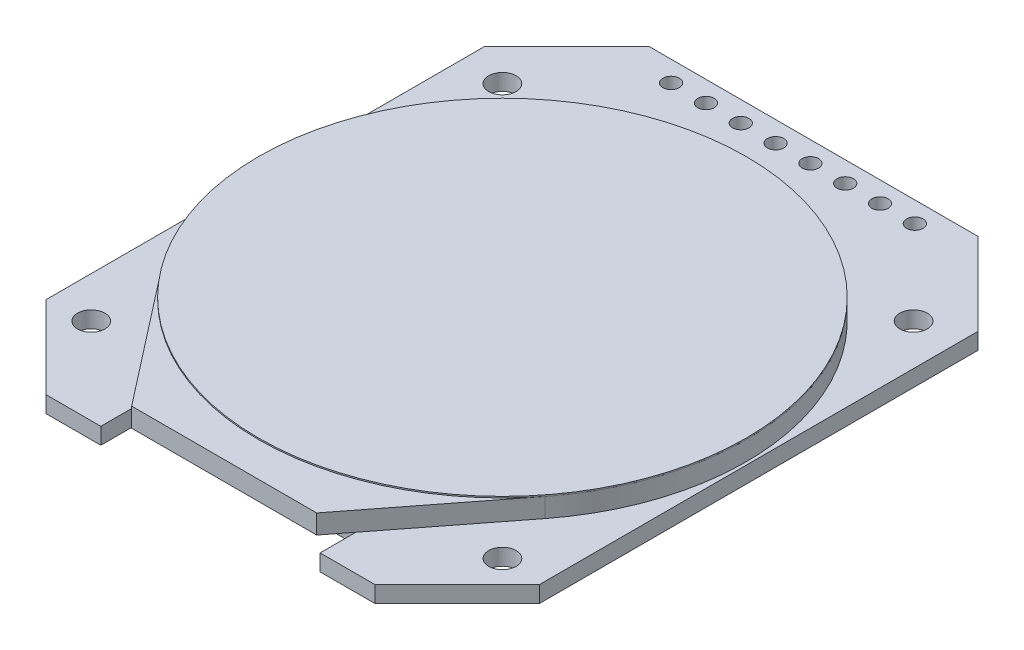
from build123d import *

# Parameters (mm, degrees)
SKETCH2_R           = 1
SKETCH2_R_2         = 0.6
SKETCH2_R_3         = 17.79
SKETCH2_R_4         = 16.2
BOSS_EXTRUDE1_DEPTH = 1.2
SKETCH2_3_R         = 17.79
SKETCH2_3_R_2       = 16.2
BOSS_EXTRUDE2_DEPTH = 1.4
BOSS_EXTRUDE3_START = 1.4
SKETCH2_4_R         = 17.79
SKETCH2_4_R_2       = 16.2
BOSS_EXTRUDE3_DEPTH = 0.1


with BuildPart() as part:
    # Sketch2 → Boss-Extrude1 (new body)
    # profile 1 of 4: a face of its own
    with BuildSketch(Plane(origin=(0, 0, 0), x_dir=(1, 0, 0), z_dir=(0, 1, 0))):
        with BuildLine():
            Line((-18, 16), (-18, -16))
            Line((-18, -16), (-12, -22))
            Line((-12, -22), (-8, -22))
            Line((-8, -22), (-8, -19.392543934))
            Line((-8, -19.392543934), (-14.043607284, -11.620677381))
            ThreePointArc((-14.043607284, -11.620677381), (-5.772708481, 16.127356797), (17.79, -0.7))
            ThreePointArc((17.79, -0.7), (16.827356797, -6.472708481), (14.043607284, -11.620677381))
            Line((14.043607284, -11.620677381), (8, -19.392543934))
            Line((8, -19.392543934), (8, -22))
            Line((8, -22), (12, -22))
            Line((12, -22), (18, -16))
            Line((18, -16), (18, 16))
            Line((18, 16), (12, 22))
            Line((12, 22), (-12, 22))
            Line((-12, 22), (-18, 16))
        make_face()
        with Locations(Location((-15, -15.7, 0), (0, 0, 270))):
            Circle(SKETCH2_R, mode=Mode.SUBTRACT)
        with Locations(Location((15, -15.7, 0), (0, 0, 270))):
            Circle(SKETCH2_R, mode=Mode.SUBTRACT)
        with Locations(Location((-15, 14.3, 0), (0, 0, 270))):
            Circle(SKETCH2_R, mode=Mode.SUBTRACT)
        with Locations(Location((-8.89, 20.5, 0), (0, 0, 270))):
            Circle(SKETCH2_R_2, mode=Mode.SUBTRACT)
        with Locations(Location((-6.35, 20.5, 0), (0, 0, 270))):
            Circle(SKETCH2_R_2, mode=Mode.SUBTRACT)
        with Locations(Location((-3.81, 20.5, 0), (0, 0, 270))):
            Circle(SKETCH2_R_2, mode=Mode.SUBTRACT)
        with Locations(Location((-1.27, 20.5, 0), (0, 0, 270))):
            Circle(SKETCH2_R_2, mode=Mode.SUBTRACT)
        with Locations(Location((1.27, 20.5, 0), (0, 0, 270))):
            Circle(SKETCH2_R_2, mode=Mode.SUBTRACT)
        with Locations(Location((3.81, 20.5, 0), (0, 0, 270))):
            Circle(SKETCH2_R_2, mode=Mode.SUBTRACT)
        with Locations(Location((6.35, 20.5, 0), (0, 0, 270))):
            Circle(SKETCH2_R_2, mode=Mode.SUBTRACT)
        with Locations(Location((8.89, 20.5, 0), (0, 0, 270))):
            Circle(SKETCH2_R_2, mode=Mode.SUBTRACT)
        with Locations(Location((15, 14.3, 0), (0, 0, 270))):
            Circle(SKETCH2_R, mode=Mode.SUBTRACT)
    # profile 2 of 4: a face of its own
    with BuildSketch(Plane(origin=(0, 0, 0), x_dir=(1, 0, 0), z_dir=(0, 1, 0))):
        with Locations((0, -0.7)):
            Circle(SKETCH2_R_3)
        with Locations((0, -0.7)):
            Circle(SKETCH2_R_4, mode=Mode.SUBTRACT)
    # profile 3 of 4: a face of its own
    with BuildSketch(Plane(origin=(0, 0, 0), x_dir=(1, 0, 0), z_dir=(0, 1, 0))):
        with Locations((0, -0.7)):
            Circle(SKETCH2_R_4)
    # profile 4 of 4: a face of its own
    with BuildSketch(Plane(origin=(0, 0, 0), x_dir=(1, 0, 0), z_dir=(0, 1, 0))):
        with BuildLine():
            Line((-14.043607284, -11.620677381), (-8, -19.392543934))
            Line((-8, -19.392543934), (-8, -19))
            Line((-8, -19), (8, -19))
            Line((8, -19), (8, -19.392543934))
            Line((8, -19.392543934), (14.043607284, -11.620677381))
            ThreePointArc((14.043607284, -11.620677381), (0, -18.49), (-14.043607284, -11.620677381))
        make_face()
    extrude(amount=-BOSS_EXTRUDE1_DEPTH)


with BuildPart() as body_2:
    # Sketch2<3> → Boss-Extrude2 (new body)
    # profile 1 of 4: a face of its own
    with BuildSketch(Plane(origin=(0, 0, 0), x_dir=(1, 0, 0), z_dir=(0, 1, 0))):
        with BuildLine():
            Line((-14.043607284, -11.620677381), (-8, -19.392543934))
            Line((-8, -19.392543934), (-8, -19))
            Line((-8, -19), (8, -19))
            Line((8, -19), (8, -19.392543934))
            Line((8, -19.392543934), (14.043607284, -11.620677381))
            ThreePointArc((14.043607284, -11.620677381), (0, -18.49), (-14.043607284, -11.620677381))
        make_face()
    # profile 2 of 4: a face of its own
    with BuildSketch(Plane(origin=(0, 0, 0), x_dir=(1, 0, 0), z_dir=(0, 1, 0))):
        with Locations((0, -0.7)):
            Circle(SKETCH2_3_R)
        with Locations((0, -0.7)):
            Circle(SKETCH2_3_R_2, mode=Mode.SUBTRACT)
    # profile 3 of 4: a face of its own
    with BuildSketch(Plane(origin=(0, 0, 0), x_dir=(1, 0, 0), z_dir=(0, 1, 0))):
        Polygon((-8, -19), (-8, -19.392543934), (-6.75, -21), (6.75, -21), (8, -19.392543934), (8, -19), align=None)
    # profile 4 of 4: a face of its own
    with BuildSketch(Plane(origin=(0, 0, 0), x_dir=(1, 0, 0), z_dir=(0, 1, 0))):
        with Locations((0, -0.7)):
            Circle(SKETCH2_3_R_2)
    extrude(amount=BOSS_EXTRUDE2_DEPTH)


with BuildPart() as body_3:
    # Sketch2<4> → Boss-Extrude3 (new body)
    # profile 1 of 2: a face of its own
    with BuildSketch(Plane(origin=(0, 0, 0), x_dir=(1, 0, 0), z_dir=(0, 1, 0)).offset(BOSS_EXTRUDE3_START)):
        with Locations(Location((0, -0.7, 0), (0, 0, 270))):
            Circle(SKETCH2_4_R)
        with Locations((0, -0.7)):
            Circle(SKETCH2_4_R_2, mode=Mode.SUBTRACT)
    # profile 2 of 2: a face of its own
    with BuildSketch(Plane(origin=(0, 0, 0), x_dir=(1, 0, 0), z_dir=(0, 1, 0)).offset(BOSS_EXTRUDE3_START)):
        with Locations((0, -0.7)):
            Circle(SKETCH2_4_R_2)
    extrude(amount=BOSS_EXTRUDE3_DEPTH)


solid = Compound([part.part, body_2.part, body_3.part])
